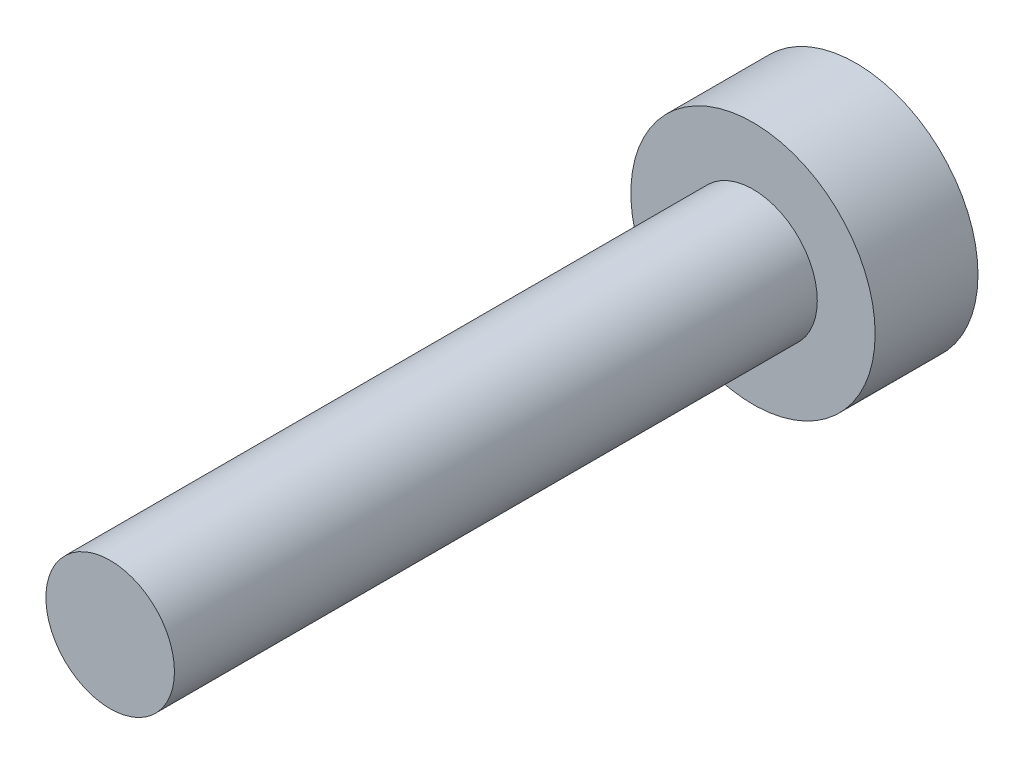
from build123d import *

# Parameters (mm, degrees)
SKETCH_1_R        = 1
EXTRUDE_10_DEPTH  = 10
EXTRUDE_START     = -1.6
SKETCH_2_R        = 1.9
EXTRUDE_315_DEPTH = 1.6


with BuildPart() as part:
    # 草图1 → 公称杆长10_无牙型参考 (new body)
    with BuildSketch(Plane.XY):
        Circle(SKETCH_1_R)
    extrude(amount=EXTRUDE_10_DEPTH)

    # 草图2 → Extrude 315 (add)
    with BuildSketch(Plane.XY.offset(EXTRUDE_START)):
        Circle(SKETCH_2_R)
    extrude(amount=EXTRUDE_315_DEPTH)


solid = part.part
